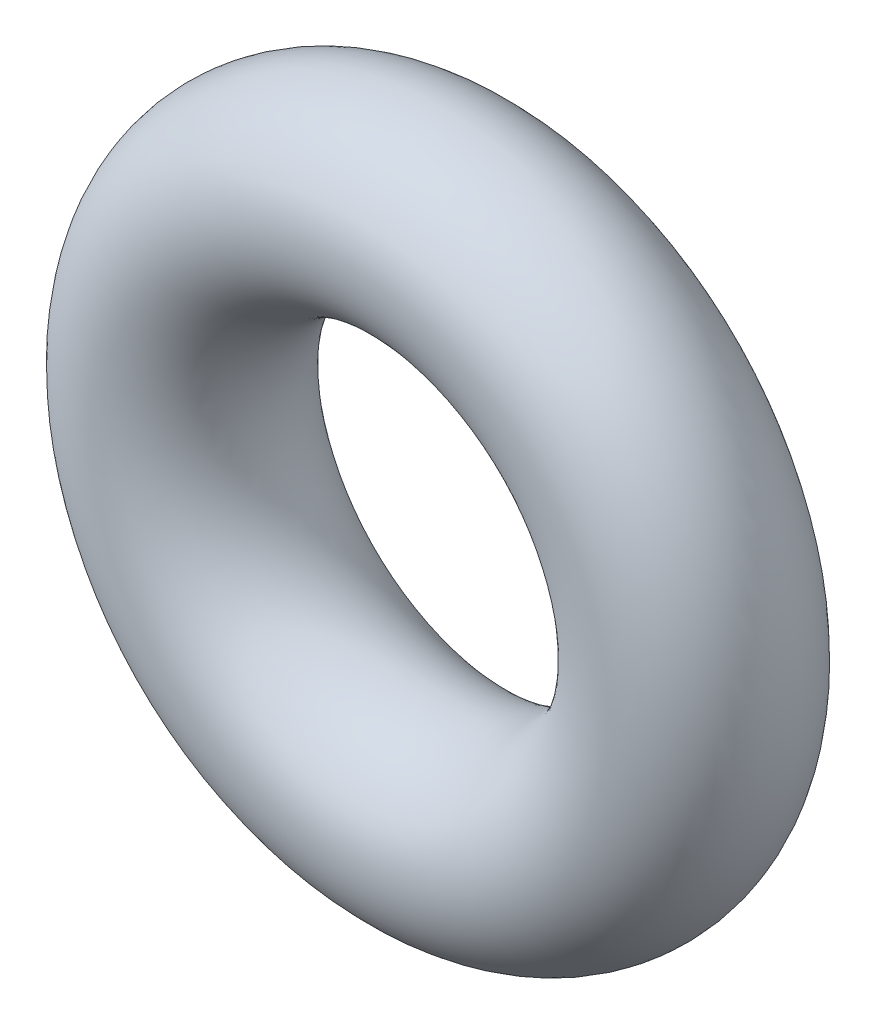
from build123d import *

# Parameters (mm, degrees)
SKETCH2_R = 0.75


with BuildPart() as part:
    # Sketch2 → Revolve1 (revolve)
    with BuildSketch(Plane(origin=(0, 0, 0), x_dir=(1, 0, 0), z_dir=(0, 1, 0)), mode=Mode.PRIVATE) as revolve1_sk:
        with Locations((2, 0)):
            Circle(SKETCH2_R)
    revolve(revolve1_sk.sketch.rotate(Axis((0, 0, -0.75), (0, 0, 1)), 180), axis=Axis((0, 0, -0.75), (0, 0, 1)))


solid = part.part
